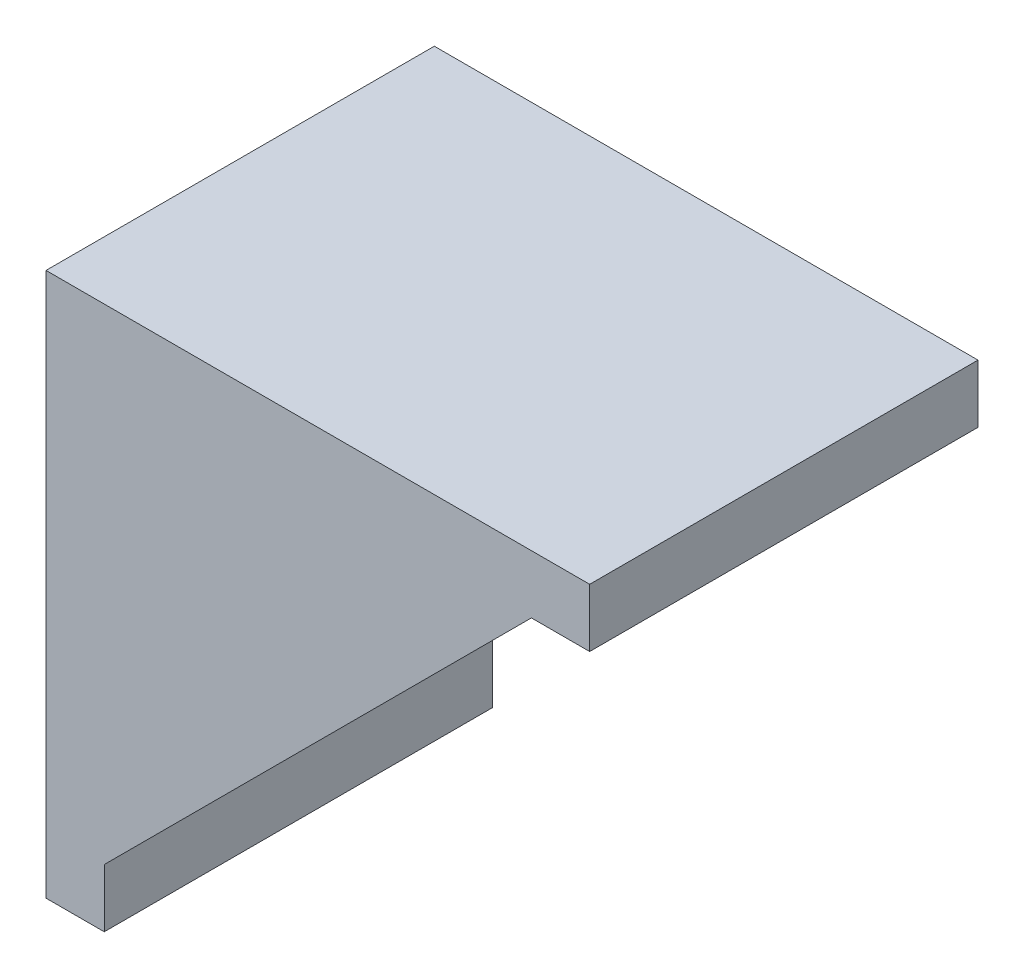
from build123d import *

# Parameters (mm, degrees)
EXTRUDE_1_DEPTH = 20


with BuildPart() as part:
    # 草圖1 → 填料-伸長1 (new body)
    with BuildSketch(Plane.XY):
        Polygon((-11, -11), (11, 11), (14, 11), (14, 14), (-14, 14), (-14, -14), (-11, -14), align=None)
    extrude(amount=EXTRUDE_1_DEPTH)


solid = part.part
